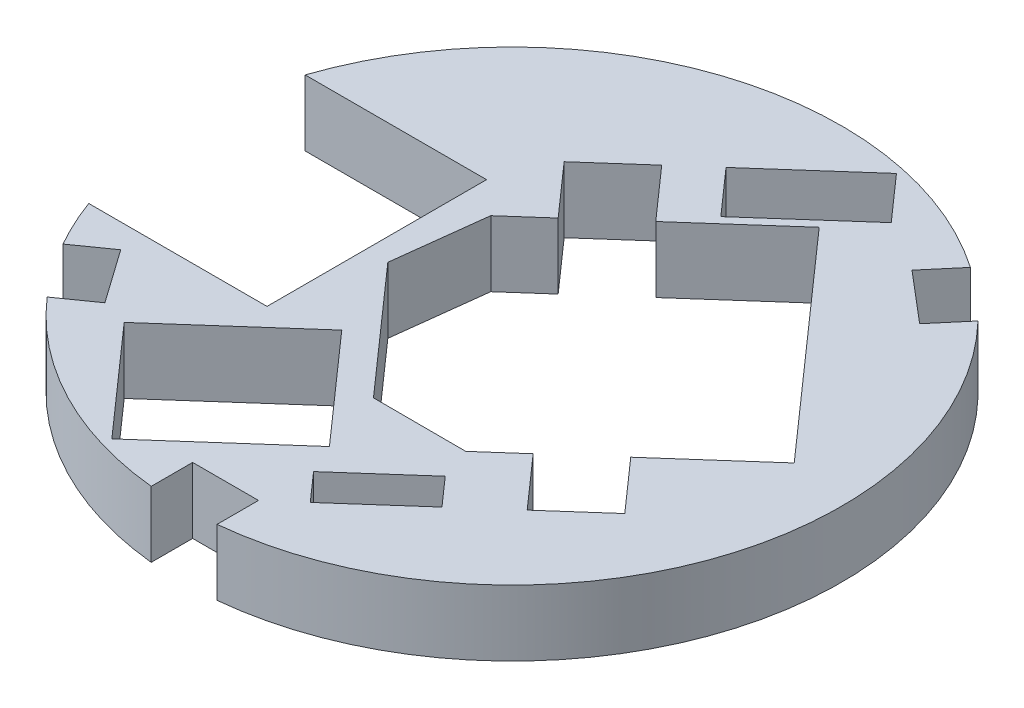
from build123d import *

# Parameters (mm, degrees)
SKETCH1_R           = 1.143
BOSS_EXTRUDE1_DEPTH = 1.524
SKETCH2_R           = 1.524
SKETCH2_R_2         = 1.143
CUT_EXTRUDE1_DEPTH  = 25.96925768
SKETCH4_R           = 20.695463349
SKETCH4_R_2         = 15.2527
CUT_EXTRUDE2_DEPTH  = 25.96925768
BOSS_EXTRUDE2_DEPTH = 3.048
BOSS_EXTRUDE3_DEPTH = 3.048


with BuildPart() as part:
    # Sketch1 → Boss-Extrude1 (new, symmetric)
    with BuildSketch(Plane(origin=(0, 0, 0), x_dir=(1, 0, 0), z_dir=(0, 1, 0))):
        with BuildLine():
            ThreePointArc((-17.060660873, -5.2832), (-0.126583546, -17.859516463), (16.984058744, -5.5245))
            Line((16.984058744, -5.5245), (16.984058744, 5.5245))
            ThreePointArc((16.984058744, 5.5245), (-0.338525345, 17.856756488), (-17.181244816, 4.8768))
            Line((-17.181244816, 4.8768), (-6.056265338, 4.8768))
            Line((-6.056265338, 4.8768), (-6.056265338, -5.2832))
            Line((-6.056265338, -5.2832), (-17.060660873, -5.2832))
        make_face()
        with Locations(Location((8.579035657, 10.1092, 0), (0, 0, 90))):
            Circle(SKETCH1_R, mode=Mode.SUBTRACT)
        with Locations(Location((0, -13.2588, 0), (0, 0, 90))):
            Circle(SKETCH1_R, mode=Mode.SUBTRACT)
        with Locations(Location((-10.832526773, -7.6454, 0), (0, 0, 90))):
            Circle(SKETCH1_R, mode=Mode.SUBTRACT)
        Polygon((6.036511594, -9.279669889), (4.875306175, -7.966959435), (1.641092014, -10.827900322), (2.802297432, -12.140610776), align=None, mode=Mode.SUBTRACT)
        Polygon((-5.027565338, -0.720652536), (-2.425370717, -3.662361234), (-8.720293025, -9.230761998), (-4.338426069, -14.184340812), (6.008776335, -5.031349407), (8.129238404, -7.428472845), (10.526361842, -5.308010776), (8.405899773, -2.910887338), (12.420130291, 0.640045174), (3.551213542, 10.666109075), (-0.463016976, 7.115176563), (-2.583479045, 9.5123), (-4.980602482, 7.391837931), (-2.860140414, 4.994714494), (-4.515281158, 3.5306), align=None, mode=Mode.SUBTRACT)
        Polygon((0.846775502, 8.816385505), (5.032229122, 12.518779594), (3.181032078, 14.611506404), (-1.004421543, 10.909112315), align=None, mode=Mode.SUBTRACT)
    extrude(amount=BOSS_EXTRUDE1_DEPTH, both=True)

    # Sketch2 → Cut-Extrude1 (cut, through all)
    # profile 1 of 6: a face of its own
    with BuildSketch(Plane(origin=(0, 1.524, 0), x_dir=(1, 0, 0), z_dir=(0, 1, 0))):
        with Locations((-10.832526773, -7.6454)):
            Circle(SKETCH2_R)
        with Locations((-10.832526773, -7.6454)):
            Circle(SKETCH2_R_2, mode=Mode.SUBTRACT)
    # profile 2 of 6: a face of its own
    with BuildSketch(Plane(origin=(0, 1.524, 0), x_dir=(1, 0, 0), z_dir=(0, 1, 0))):
        with BuildLine():
            ThreePointArc((-15.417270145, -9.015882261), (-14.591708872, -10.298562224), (-13.659706927, -11.506118301))
            Line((-13.659706927, -11.506118301), (-9.953745163, -8.89051802))
            ThreePointArc((-9.953745163, -8.89051802), (-12.077644792, -8.524181609), (-11.711308382, -6.40028198))
            Line((-11.711308382, -6.40028198), (-15.417270145, -9.015882261))
        make_face()
    # profile 3 of 6: a face of its own
    with BuildSketch(Plane(origin=(0, 1.524, 0), x_dir=(1, 0, 0), z_dir=(0, 1, 0))):
        with BuildLine():
            ThreePointArc((1.524, -13.2588), (0, -14.7828), (-1.524, -13.2588))
            Line((-1.524, -13.2588), (-1.524, -17.794824407))
            ThreePointArc((-1.524, -17.794824407), (0, -17.859965052), (1.524, -17.794824407))
            Line((1.524, -17.794824407), (1.524, -13.2588))
        make_face()
    # profile 4 of 6: a face of its own
    with BuildSketch(Plane(origin=(0, 1.524, 0), x_dir=(1, 0, 0), z_dir=(0, 1, 0))):
        with Locations((0, -13.2588)):
            Circle(SKETCH2_R)
        with Locations((0, -13.2588)):
            Circle(SKETCH2_R_2, mode=Mode.SUBTRACT)
    # profile 5 of 6: a face of its own
    with BuildSketch(Plane(origin=(0, 1.524, 0), x_dir=(1, 0, 0), z_dir=(0, 1, 0))):
        with BuildLine():
            Line((10.352068988, 14.55379742), (7.417058645, 11.095296053))
            ThreePointArc((7.417058645, 11.095296053), (9.104260863, 11.539834294), (10.103035657, 10.1092))
            ThreePointArc((10.103035657, 10.1092), (10.009669951, 9.583974794), (9.741012668, 9.123103947))
            Line((9.741012668, 9.123103947), (12.676023011, 12.581605315))
            ThreePointArc((12.676023011, 12.581605315), (11.556194906, 13.61736799), (10.352068988, 14.55379742))
        make_face()
    # profile 6 of 6: a face of its own
    with BuildSketch(Plane(origin=(0, 1.524, 0), x_dir=(1, 0, 0), z_dir=(0, 1, 0))):
        with Locations((8.579035657, 10.1092)):
            Circle(SKETCH2_R)
        with Locations((8.579035657, 10.1092)):
            Circle(SKETCH2_R_2, mode=Mode.SUBTRACT)
    extrude(amount=-CUT_EXTRUDE1_DEPTH, mode=Mode.SUBTRACT)

    # Sketch4 → Cut-Extrude2 (cut, through all)
    with BuildSketch(Plane(origin=(0, 1.524, 0), x_dir=(1, 0, 0), z_dir=(0, 1, 0))):
        Circle(SKETCH4_R)
        Circle(SKETCH4_R_2, mode=Mode.SUBTRACT)
    extrude(amount=-CUT_EXTRUDE2_DEPTH, mode=Mode.SUBTRACT)

    # Sketch5 → Boss-Extrude2 (add)
    with BuildSketch(Plane(origin=(0, 1.524, 0), x_dir=(1, 0, 0), z_dir=(0, 1, 0))):
        Polygon((-2.425370717, -3.662361234), (1.956496239, -8.615940048), (1.005256779, -9.45739325), (-3.376610176, -4.503814436), align=None)
    extrude(amount=-BOSS_EXTRUDE2_DEPTH)

    # Sketch6 → Boss-Extrude3 (add)
    with BuildSketch(Plane(origin=(0, 1.524, 0), x_dir=(1, 0, 0), z_dir=(0, 1, 0))):
        with BuildLine():
            Line((-11.711308382, -6.40028198), (-9.953745163, -8.89051802))
            ThreePointArc((-9.953745163, -8.89051802), (-9.587408753, -6.766618391), (-11.711308382, -6.40028198))
        make_face()
        with BuildLine():
            Line((-1.524, -13.2588), (1.524, -13.2588))
            ThreePointArc((1.524, -13.2588), (0, -11.7348), (-1.524, -13.2588))
        make_face()
        with BuildLine():
            Line((7.417058645, 11.095296053), (9.741012668, 9.123103947))
            ThreePointArc((9.741012668, 9.123103947), (7.592939604, 8.947222989), (7.417058645, 11.095296053))
        make_face()
        Polygon((4.353635591, -6.495463901), (0.071641066, -6.485163659), (1.956496239, -8.615940048), align=None)
    extrude(amount=-BOSS_EXTRUDE3_DEPTH)


solid = part.part
